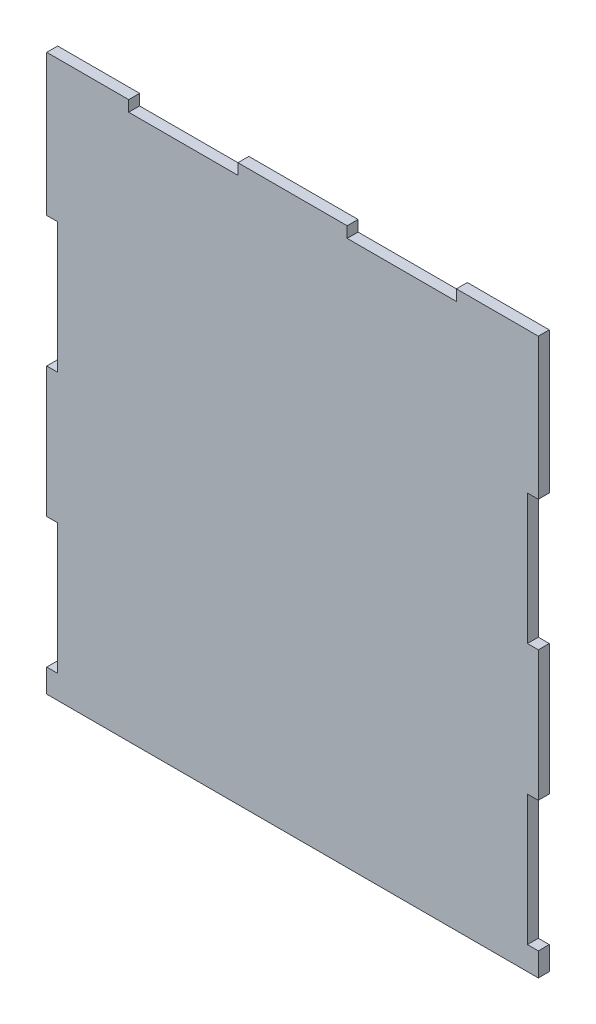
from build123d import *

# Parameters (mm, degrees)
BOSS_EXTRUDE1_DEPTH = 3


with BuildPart() as part:
    # Sketch1 → Boss-Extrude1 (new body)
    with BuildSketch(Plane.XY):
        Polygon((0, 0), (129, 0), (132, 0), (132, 6.45), (129, 6.45), (129, 42.25), (132, 42.25), (132, 78.05), (129, 78.05), (129, 113.85), (132, 113.85), (132, 149.65), (132, 152.65), (129, 152.65), (109.5, 152.65), (109.5, 149.65), (79.5, 149.65), (79.5, 152.65), (49.5, 152.65), (49.5, 149.65), (19.5, 149.65), (19.5, 152.65), (0, 152.65), (-3, 152.65), (-3, 149.65), (-3, 113.85), (0, 113.85), (0, 78.05), (-3, 78.05), (-3, 42.25), (0, 42.25), (0, 6.45), (-3, 6.45), (-3, 0), align=None)
    extrude(amount=BOSS_EXTRUDE1_DEPTH)


solid = part.part
